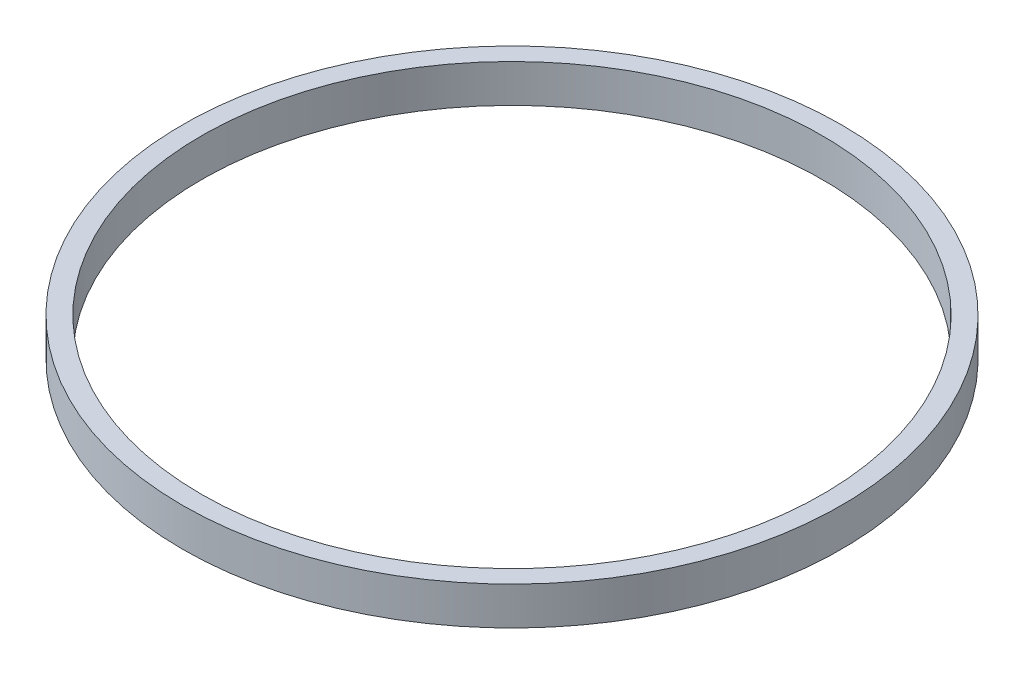
from build123d import *

# Parameters (mm, degrees)
SKETCH_1_R      = 26
SKETCH_1_R_2    = 24.5
EXTRUDE_1_DEPTH = 3


with BuildPart() as part:
    # Эскиз1 → Бобышка-Вытянуть1 (new body)
    with BuildSketch(Plane(origin=(0, 0, 0), x_dir=(1, 0, 0), z_dir=(0, 1, 0))):
        with Locations(Location((0, 0, 0), (0, 0, 270))):
            Circle(SKETCH_1_R)
        with Locations(Location((0, 0, 0), (0, 0, 270))):
            Circle(SKETCH_1_R_2, mode=Mode.SUBTRACT)
    extrude(amount=EXTRUDE_1_DEPTH)


solid = part.part
